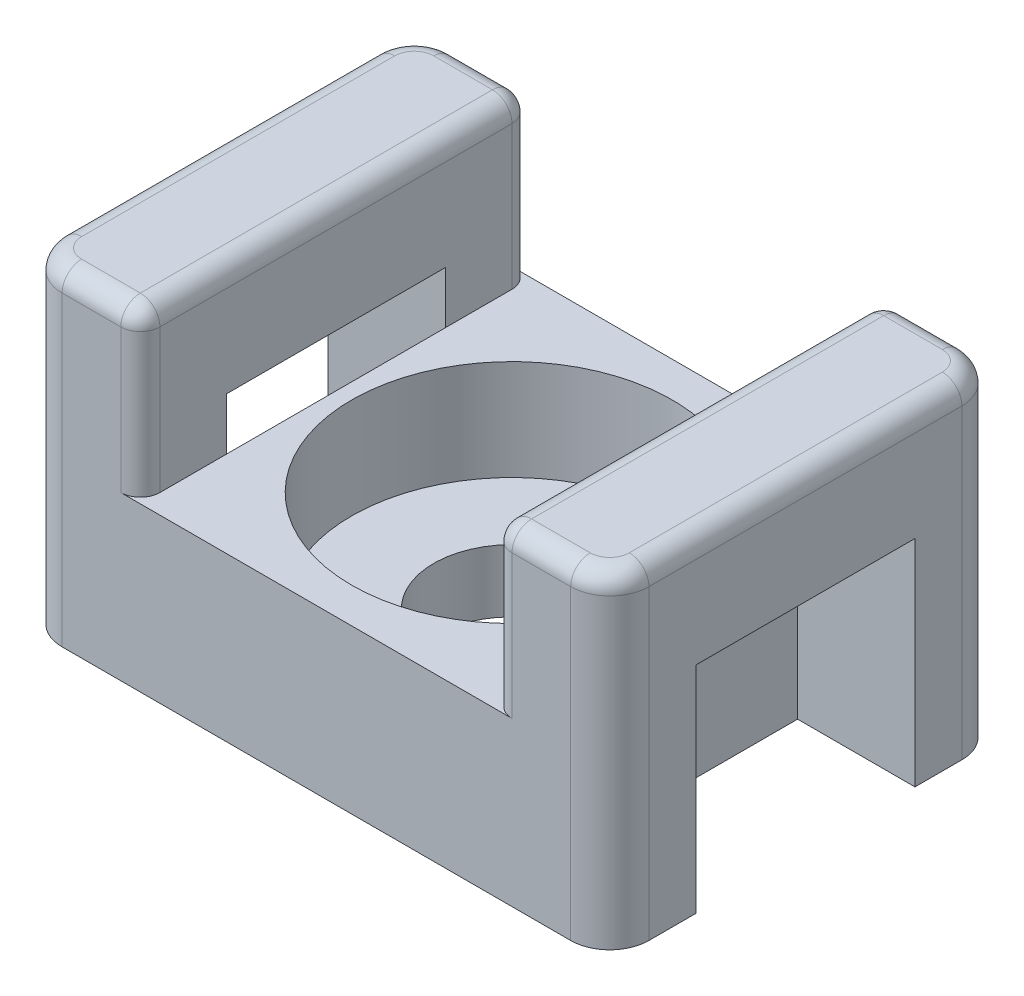
from build123d import *

# Parameters (mm, degrees)
SKETCH1_W               = 14.2875
SKETCH1_H               = 9.525
SKETCH1_R               = 1.905
BOSS_EXTRUDE1_DEPTH     = 7.9375
SKETCH2_W               = 8.5725
SKETCH2_H               = 3.96875
CUT_EXTRUDE1_DEPTH      = 15.309531624
CUT_EXTRUDE2_DEPTH      = 12.692667641
CUT_EXTRUDE2_DEPTH_BACK = 12.692667641
SKETCH3_W               = 5.334
SKETCH3_H               = 1.27
SKETCH4_W               = 5.334
SKETCH4_H               = 3.96875
CUT_EXTRUDE3_DEPTH      = 2.8575
SKETCH5_W               = 5.334
SKETCH5_H               = 3.96875
CUT_EXTRUDE4_DEPTH      = 2.8575
SKETCH6_R               = 3.90525
CUT_EXTRUDE5_DEPTH      = 2.44475
FILLET2_R               = 0.9525
FILLET3_R               = 0.47625


with BuildPart() as part:
    # Sketch1 → Boss-Extrude1 (new body)
    with BuildSketch(Plane(origin=(0, 0, 0), x_dir=(1, 0, 0), z_dir=(0, 1, 0))):
        Rectangle(SKETCH1_W, SKETCH1_H)
        with Locations(Location((0, 0, 0), (0, 0, 270))):
            Circle(SKETCH1_R, mode=Mode.SUBTRACT)
    extrude(amount=BOSS_EXTRUDE1_DEPTH)

    # Sketch2 → Cut-Extrude1 (cut, through all)
    with BuildSketch(Plane.XY.offset(4.7625)):
        with Locations((0, 5.953125)):
            Rectangle(SKETCH2_W, SKETCH2_H)
    extrude(amount=-CUT_EXTRUDE1_DEPTH, mode=Mode.SUBTRACT)

    # Sketch3 → Cut-Extrude2 (cut, two sides: drawn at the far end of the back side and taken through both)
    with BuildSketch(Plane(origin=(0, 0, 0), x_dir=(0, 0, -1), z_dir=(1, 0, 0)).offset(-CUT_EXTRUDE2_DEPTH_BACK)):
        with Locations((0, 4.60375)):
            Rectangle(SKETCH3_W, SKETCH3_H)
    extrude(amount=CUT_EXTRUDE2_DEPTH + CUT_EXTRUDE2_DEPTH_BACK, mode=Mode.SUBTRACT)

    # Sketch4 → Cut-Extrude3 (cut)
    with BuildSketch(Plane(origin=(7.14375, 0, 0), x_dir=(0, 0, -1), z_dir=(1, 0, 0))):
        with Locations((0, 1.984375)):
            Rectangle(SKETCH4_W, SKETCH4_H)
    extrude(amount=-CUT_EXTRUDE3_DEPTH, mode=Mode.SUBTRACT)

    # Sketch5 → Cut-Extrude4 (cut)
    with BuildSketch(Plane.ZY.offset(7.14375)):
        with Locations((0, 1.984375)):
            Rectangle(SKETCH5_W, SKETCH5_H)
    extrude(amount=-CUT_EXTRUDE4_DEPTH, mode=Mode.SUBTRACT)

    # Sketch6 → Cut-Extrude5 (cut)
    with BuildSketch(Plane(origin=(0, 3.96875, 0), x_dir=(1, 0, 0), z_dir=(0, 1, 0))):
        with Locations(Location((0, 0, 0), (0, 0, 270))):
            Circle(SKETCH6_R)
    extrude(amount=-CUT_EXTRUDE5_DEPTH, mode=Mode.SUBTRACT)

    # Fillet2
    fillet2_edges = [part.edges().sort_by_distance(p)[0] for p in [
        (-7.14375, 3.96875, 4.7625),
        (7.14375, 3.96875, 4.7625),
        (-7.14375, 3.96875, -4.7625),
        (7.14375, 3.96875, -4.7625),
    ]]
    fillet(fillet2_edges, radius=FILLET2_R)

    # Fillet3
    fillet3_edges = [part.edges().sort_by_distance(p)[0] for p in [
        (5.23875, 7.9375, 4.7625),
        (-5.23875, 7.9375, 4.7625),
        (4.28625, 5.953125, 4.7625),
        (-4.28625, 5.953125, 4.7625),
        (6.864769209, 7.9375, 4.483519209),
        (-6.864769209, 7.9375, 4.483519209),
        (7.14375, 7.9375, 0),
        (6.864769209, 7.9375, -4.483519209),
        (5.23875, 7.9375, -4.7625),
        (4.28625, 7.9375, 0),
        (-5.23875, 7.9375, -4.7625),
        (-6.864769209, 7.9375, -4.483519209),
        (-4.28625, 7.9375, 0),
        (-7.14375, 7.9375, 0),
        (4.28625, 5.953125, -4.7625),
        (-4.28625, 5.953125, -4.7625),
    ]]
    fillet(fillet3_edges, radius=FILLET3_R)


solid = part.part
